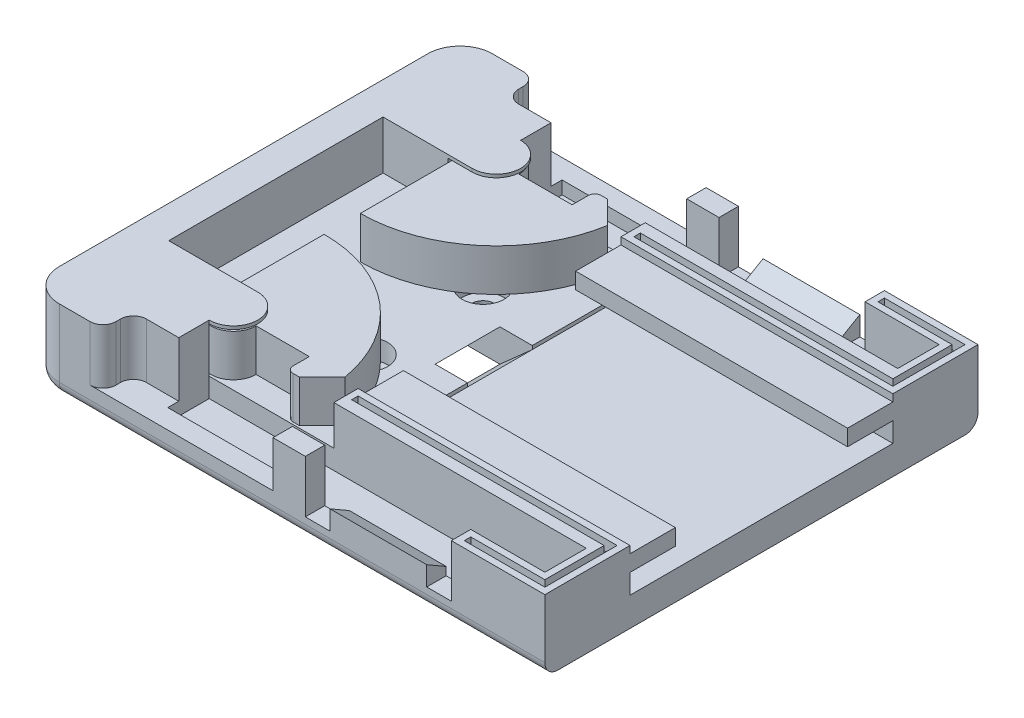
from build123d import *

# Parameters (mm, degrees)
SKETCH1_R           = 2.25
BOSS_EXTRUDE1_DEPTH = 7.5
SKETCH2_W           = 80
SKETCH2_H           = 33.45
BOSS_EXTRUDE2_DEPTH = 5
SKETCH3_W           = 19.25
SKETCH3_H           = 7.5
CUT_EXTRUDE1_DEPTH  = 3
SKETCH4_W           = 58.25
SKETCH4_H           = 6.4
CUT_EXTRUDE2_DEPTH  = 3
SKETCH5_W           = 7
SKETCH5_H           = 2.5
BOSS_EXTRUDE3_DEPTH = 42
SKETCH6_W           = 40.4
SKETCH6_H           = 20.3
CUT_EXTRUDE3_DEPTH  = 0.55
BOSS_EXTRUDE4_START = 0.1
SKETCH7_R           = 2.6
BOSS_EXTRUDE4_DEPTH = 6.5
BOSS_EXTRUDE5_START = -0.5
BOSS_EXTRUDE5_DEPTH = 0.5
SKETCH9_W           = 7
SKETCH9_H           = 4.7
CUT_EXTRUDE4_DEPTH  = 7.5
CUT_EXTRUDE5_DEPTH  = 1
FILLET2_R           = 2
FILLET3_R           = 1
FILLET4_R           = 5
FILLET5_R           = 2
CUT_EXTRUDE11_DEPTH = 5
CUT_EXTRUDE12_DEPTH = 14.95
SKETCH17_W          = 42
SKETCH17_H          = 13.15
CUT_EXTRUDE13_DEPTH = 1.4
CUT_EXTRUDE14_DEPTH = 1.7
SKETCH19_R          = 3.25
SKETCH19_R_2        = 1.7
CUT_EXTRUDE15_DEPTH = 3
SKETCH20_R          = 1.7
CUT_EXTRUDE16_DEPTH = 105.813453335


with BuildPart() as part:
    # Sketch1 → Boss-Extrude1 (new body)
    with BuildSketch(Plane(origin=(0, 0, 0), x_dir=(1, 0, 0), z_dir=(0, 1, 0))):
        with BuildLine():
            Line((5, 16.9), (5, 33.45))
            Line((5, 33.45), (0, 33.45))
            Line((0, 33.45), (0, 0))
            Line((0, 0), (80, 0))
            Line((80, 0), (80, 9.4))
            Line((80, 9.4), (77, 9.4))
            Line((77, 9.4), (77, 3))
            Line((77, 3), (18.75, 3))
            Line((18.75, 3), (18.75, 9.4))
            ThreePointArc((18.75, 9.4), (16.098349571, 10.498349571), (15, 13.15))
            Line((15, 13.15), (15, 16.9))
            Line((15, 16.9), (5, 16.9))
        make_face()
        with Locations(Location((18.75, 13.15, 0), (0, 0, 270))):
            Circle(SKETCH1_R)
        Polygon((80, 9.4), (80, 13.15), (38, 13.15), (38, 9.4), (77, 9.4), align=None)
    extrude(amount=BOSS_EXTRUDE1_DEPTH)

    # Sketch2 → Boss-Extrude2 (add)
    with BuildSketch(Plane(origin=(0, 0, 0), x_dir=(-1, 0, 0), z_dir=(0, -1, 0))):
        with Locations((-40, 16.725)):
            Rectangle(SKETCH2_W, SKETCH2_H)
    extrude(amount=BOSS_EXTRUDE2_DEPTH)

    # Sketch3 → Cut-Extrude1 (cut)
    with BuildSketch(Plane.XY):
        Polygon((65.55, 6.1), (43, 6.1), (43, -2), (46.8, -2), (46.8, 1.5), (61.75, 1.5), (61.75, -2), (65.55, -2), align=None)
        with Locations((28.375, 3.75)):
            Rectangle(SKETCH3_W, SKETCH3_H)
    extrude(amount=-CUT_EXTRUDE1_DEPTH, mode=Mode.SUBTRACT)

    # Sketch4 → Cut-Extrude2 (cut)
    with BuildSketch(Plane(origin=(0, 0, 0), x_dir=(1, 0, 0), z_dir=(0, 1, 0))):
        with Locations((47.875, 6.2)):
            Rectangle(SKETCH4_W, SKETCH4_H)
    extrude(amount=-CUT_EXTRUDE2_DEPTH, mode=Mode.SUBTRACT)

    # Sketch5 → Boss-Extrude3 (add)
    with BuildSketch(Plane(origin=(80, 0, 0), x_dir=(0, 0, -1), z_dir=(1, 0, 0))):
        with Locations((16.65, 3.75)):
            Rectangle(SKETCH5_W, SKETCH5_H)
    extrude(amount=-BOSS_EXTRUDE3_DEPTH)

    # Sketch6 → Cut-Extrude3 (cut)
    with BuildSketch(Plane(origin=(0, 0, 0), x_dir=(1, 0, 0), z_dir=(0, 1, 0))):
        with Locations((59.8, 23.3)):
            Rectangle(SKETCH6_W, SKETCH6_H)
    extrude(amount=-CUT_EXTRUDE3_DEPTH, mode=Mode.SUBTRACT)

    # Sketch8 → Boss-Extrude5 (add)
    with BuildSketch(Plane(origin=(0, 7.5, 0), x_dir=(1, 0, 0), z_dir=(0, 1, 0)).offset(BOSS_EXTRUDE5_START)):
        with BuildLine():
            Line((15, 16.9), (15, 13.15))
            ThreePointArc((15, 13.15), (21.401650429, 10.498349571), (18.75, 16.9))
            Line((18.75, 16.9), (15, 16.9))
        make_face()
    extrude(amount=BOSS_EXTRUDE5_DEPTH)

    # Sketch9 → Cut-Extrude4 (cut)
    with BuildSketch(Plane(origin=(0, 7.5, 0), x_dir=(1, 0, 0), z_dir=(0, 1, 0))):
        with Locations((15.25, 2.35)):
            Rectangle(SKETCH9_W, SKETCH9_H)
    extrude(amount=-CUT_EXTRUDE4_DEPTH, mode=Mode.SUBTRACT)

    # Sketch10 → Cut-Extrude5 (cut)
    with BuildSketch(Plane(origin=(0, 0, 0), x_dir=(1, 0, 0), z_dir=(0, 1, 0))):
        Polygon((18.75, 4.7), (18.75, 3), (38, 3), (38, 0), (11.75, 0), (11.75, 4.7), align=None)
    extrude(amount=-CUT_EXTRUDE5_DEPTH, mode=Mode.SUBTRACT)

    # Fillet2
    fillet2_edges = [part.edges().sort_by_distance(p)[0] for p in [
        (11.75, 3.25, -4.7),
        (11.75, 3.25, 0),
    ]]
    fillet(fillet2_edges, radius=FILLET2_R)

    # Fillet4
    fillet4_edges = [part.edges().sort_by_distance(p)[0] for p in [
        (0, 1.25, 0),
    ]]
    fillet(fillet4_edges, radius=FILLET4_R)

    # Fillet5
    fillet5_edges = [part.edges().sort_by_distance(p)[0] for p in [
        (0, -5, -19.225),
        (1.464466094, -5, -1.464466094),
        (42.5, -5, 0),
    ]]
    fillet(fillet5_edges, radius=FILLET5_R)

    # Sketch15 → Cut-Extrude11 (cut)
    with BuildSketch(Plane(origin=(0, 0, -33.45), x_dir=(-1, 0, 0), z_dir=(0, 0, -1))):
        Polygon((-39.6, 0), (-34.6, 0), (-29.6, -5), (-34.6, -5), (-39.6, -0.55), align=None)
    extrude(amount=-CUT_EXTRUDE11_DEPTH, mode=Mode.SUBTRACT)

    # Sketch16 → Cut-Extrude12 (cut)
    with BuildSketch(Plane.ZY.offset(-46.8)):
        Polygon((-3, -0.75), (0, 0.982050808), (0, 1.5), (-3, 1.5), align=None)
    extrude(amount=-CUT_EXTRUDE12_DEPTH, mode=Mode.SUBTRACT)

    # Sketch17 → Cut-Extrude13 (cut)
    with BuildSketch(Plane(origin=(0, 7.5, 0), x_dir=(1, 0, 0), z_dir=(0, 1, 0))):
        with Locations((59, 6.575)):
            Rectangle(SKETCH17_W, SKETCH17_H)
    extrude(amount=-CUT_EXTRUDE13_DEPTH, mode=Mode.SUBTRACT)

    # Sketch18 → Cut-Extrude14 (cut)
    with BuildSketch(Plane(origin=(0, 6.1, 0), x_dir=(1, 0, 0), z_dir=(0, 1, 0))):
        Polygon((78, 11.15), (39, 11.15), (39, 12.15), (79, 12.15), (79, 1), (66.55, 1), (66.55, 2), (78, 2), align=None)
    extrude(amount=-CUT_EXTRUDE14_DEPTH, mode=Mode.SUBTRACT)

    # Mirror1: part across plane


with BuildPart() as body_2:
    # Sketch7 → Boss-Extrude4 (new body)
    with BuildSketch(Plane(origin=(0, 0, 0), x_dir=(1, 0, 0), z_dir=(0, 1, 0)).offset(BOSS_EXTRUDE4_START)):
        with BuildLine():
            Line((15.25, 30.65), (15.25, 13.15))
            ThreePointArc((15.25, 13.15), (18.75, 9.65), (22.25, 13.15))
            Line((22.25, 13.15), (30.456279241, 13.15))
            Line((30.456279241, 13.15), (30.456279241, 9.65))
            Line((30.456279241, 9.65), (32.456279241, 9.65))
            Line((32.456279241, 9.65), (35.956279241, 13.15))
            ThreePointArc((35.956279241, 13.15), (28.805441712, 25.689014932), (15.25, 30.65))
        make_face()
        with Locations(Location((18.75, 13.15, 0), (0, 0, 90))):
            Circle(SKETCH7_R, mode=Mode.SUBTRACT)
    extrude(amount=BOSS_EXTRUDE4_DEPTH)

    # Fillet3
    fillet3_edges = [body_2.edges().sort_by_distance(p)[0] for p in [
        (30.456279241, 3.35, -9.65),
    ]]
    fillet(fillet3_edges, radius=FILLET3_R)


with BuildPart() as part_1:
    add(part.part)
    add(part.part.mirror(Plane(origin=(0, -5, -33.45), x_dir=(1, 0, 0), z_dir=(0, 0, 1))))

    # Sketch19 → Cut-Extrude15 (cut)
    # profile 1 of 6: a face of its own
    with BuildSketch(Plane(origin=(0, 0, 0), x_dir=(1, 0, 0), z_dir=(0, 1, 0))):
        with Locations(Location((28, 24.45, 0), (0, 0, 270))):
            Circle(SKETCH19_R)
        with Locations((28, 24.45)):
            Circle(SKETCH19_R_2, mode=Mode.SUBTRACT)
    # profile 2 of 6: a face of its own
    with BuildSketch(Plane(origin=(0, 0, 0), x_dir=(1, 0, 0), z_dir=(0, 1, 0))):
        with Locations(Location((13, 24.45, 0), (0, 0, 270))):
            Circle(SKETCH19_R)
        with Locations((13, 24.45)):
            Circle(SKETCH19_R_2, mode=Mode.SUBTRACT)
    # profile 3 of 6: a face of its own
    with BuildSketch(Plane(origin=(0, 0, 0), x_dir=(1, 0, 0), z_dir=(0, 1, 0))):
        with Locations((13, 24.45)):
            Circle(SKETCH19_R_2)
    # profile 4 of 6: a face of its own
    with BuildSketch(Plane(origin=(0, 0, 0), x_dir=(1, 0, 0), z_dir=(0, 1, 0))):
        with Locations((28, 24.45)):
            Circle(SKETCH19_R_2)
    # profile 5 of 6: a face of its own
    with BuildSketch(Plane(origin=(0, 0, 0), x_dir=(1, 0, 0), z_dir=(0, 1, 0))):
        with Locations(Location((28, 42.45, 0), (0, 0, 270))):
            Circle(SKETCH19_R)
        with Locations((28, 42.45)):
            Circle(SKETCH19_R_2, mode=Mode.SUBTRACT)
    # profile 6 of 6: a face of its own
    with BuildSketch(Plane(origin=(0, 0, 0), x_dir=(1, 0, 0), z_dir=(0, 1, 0))):
        with Locations((28, 42.45)):
            Circle(SKETCH19_R_2)
    extrude(amount=-CUT_EXTRUDE15_DEPTH, mode=Mode.SUBTRACT)

    # Sketch20 → Cut-Extrude16 (cut, through all)
    with BuildSketch(Plane(origin=(0, -3, 0), x_dir=(1, 0, 0), z_dir=(0, 1, 0))):
        with Locations(Location((13, 24.45, 0), (0, 0, 270))):
            Circle(SKETCH20_R)
        with Locations(Location((28, 24.45, 0), (0, 0, 270))):
            Circle(SKETCH20_R)
        with Locations(Location((28, 42.45, 0), (0, 0, 270))):
            Circle(SKETCH20_R)
    extrude(amount=-CUT_EXTRUDE16_DEPTH, mode=Mode.SUBTRACT)


with BuildPart() as body_3:
    # Mirror2: mirrored copy
    add(body_2.part.mirror(Plane.XY.offset(-33.45)))


solid = Compound([body_2.part, part_1.part, body_3.part])
